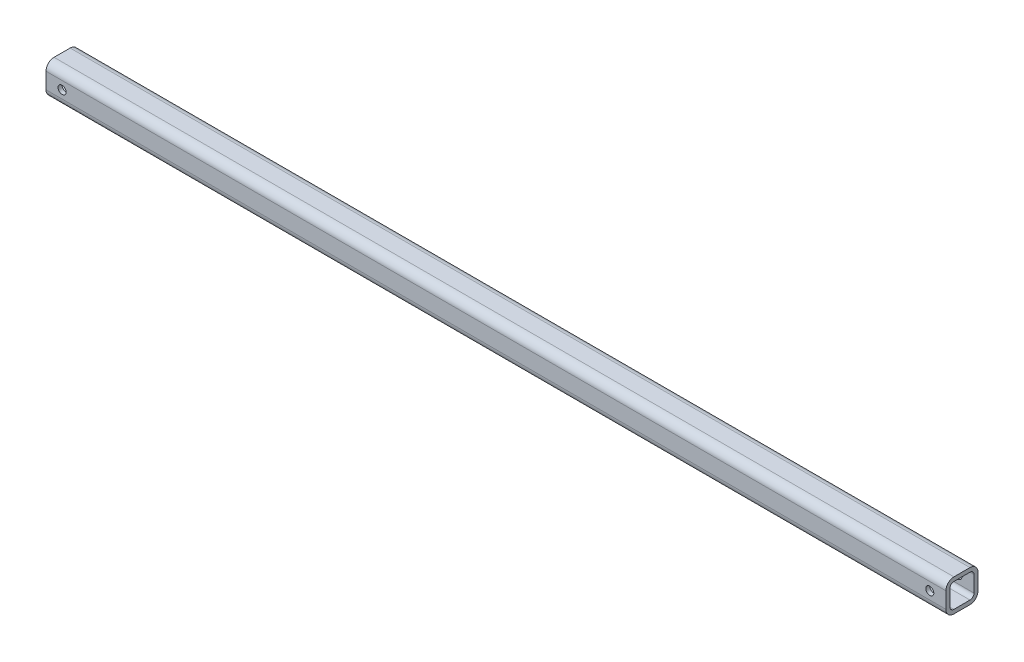
from build123d import *

# Parameters (mm, degrees)
STRUCTURAL_MEMBER1_DEPTH = 1422.4
SKETCH12_R               = 6.35
CUT_EXTRUDE1_DEPTH       = 744.764894646


with BuildPart() as part:
    # Sketch11 → Structural Member1 (new body)
    with BuildSketch(Plane.YZ.offset(-741.593162393)):
        with BuildLine():
            Line((-12.7, -25.4), (12.7, -25.4))
            ThreePointArc((12.7, -25.4), (21.680256121, -21.680256121), (25.4, -12.7))
            Line((25.4, -12.7), (25.4, 12.7))
            ThreePointArc((25.4, 12.7), (21.680256121, 21.680256121), (12.7, 25.4))
            Line((12.7, 25.4), (-12.7, 25.4))
            ThreePointArc((-12.7, 25.4), (-21.680256121, 21.680256121), (-25.4, 12.7))
            Line((-25.4, 12.7), (-25.4, -12.7))
            ThreePointArc((-25.4, -12.7), (-21.680256121, -21.680256121), (-12.7, -25.4))
        make_face()
        with BuildLine():
            Line((-12.7, -19.05), (12.7, -19.05))
            ThreePointArc((12.7, -19.05), (17.190128061, -17.190128061), (19.05, -12.7))
            Line((19.05, -12.7), (19.05, 12.7))
            ThreePointArc((19.05, 12.7), (17.190128061, 17.190128061), (12.7, 19.05))
            Line((12.7, 19.05), (-12.7, 19.05))
            ThreePointArc((-12.7, 19.05), (-17.190128061, 17.190128061), (-19.05, 12.7))
            Line((-19.05, 12.7), (-19.05, -12.7))
            ThreePointArc((-19.05, -12.7), (-17.190128061, -17.190128061), (-12.7, -19.05))
        make_face(mode=Mode.SUBTRACT)
    extrude(amount=STRUCTURAL_MEMBER1_DEPTH)

    # Sketch12 → Cut-Extrude1 (cut, through all)
    with BuildSketch(Plane.XY.offset(25.4)):
        with Locations((-716.193162393, 0)):
            Circle(SKETCH12_R)
        with Locations((655.406837607, 0)):
            Circle(SKETCH12_R)
    extrude(amount=-CUT_EXTRUDE1_DEPTH, mode=Mode.SUBTRACT)


solid = part.part
